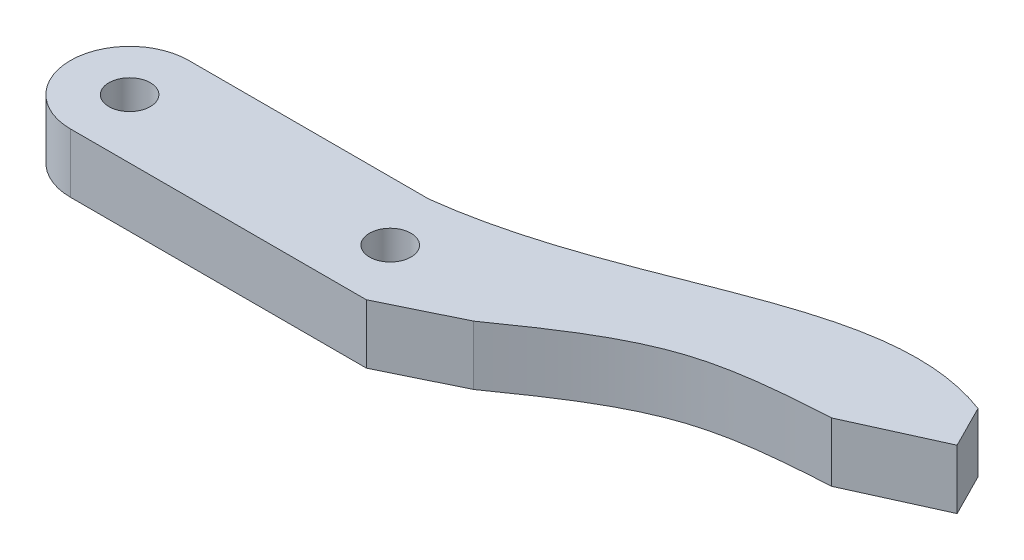
from build123d import *

# Parameters (mm, degrees)
SKETCH1_R           = 5
SKETCH1_R_2         = 1.75
BOSS_EXTRUDE1_DEPTH = 5
BOSS_EXTRUDE2_START = -5
BOSS_EXTRUDE2_DEPTH = 5


with BuildPart() as part:
    # Sketch1 → Boss-Extrude1 (new body)
    # profile 1 of 3: a face of its own
    with BuildSketch(Plane(origin=(0, 0, 0), x_dir=(1, 0, 0), z_dir=(0, 1, 0))):
        Circle(SKETCH1_R)
        with Locations(Location((0, 0, 0), (0, 0, 270))):
            Circle(SKETCH1_R_2, mode=Mode.SUBTRACT)
    # profile 2 of 3: a face of its own
    with BuildSketch(Plane(origin=(0, 0, 0), x_dir=(1, 0, 0), z_dir=(0, 1, 0))):
        with BuildLine():
            Line((22, 5), (7e-09, 5))
            ThreePointArc((7e-09, 5), (3.535533908, 3.535533903), (5, 0))
            ThreePointArc((5, 0), (3.535533907, -3.535533905), (3e-09, -5))
            Line((3e-09, -5), (22, -5))
            ThreePointArc((22, -5), (17, 0), (22, 5))
        make_face()
    # profile 3 of 3: a face of its own
    with BuildSketch(Plane(origin=(0, 0, 0), x_dir=(1, 0, 0), z_dir=(0, 1, 0))):
        with Locations((22, 0)):
            Circle(SKETCH1_R)
        with Locations(Location((22, 0, 0), (0, 0, 270))):
            Circle(SKETCH1_R_2, mode=Mode.SUBTRACT)
    extrude(amount=BOSS_EXTRUDE1_DEPTH)

    # Sketch2 → Boss-Extrude2 (add)
    with BuildSketch(Plane(origin=(0, 5, 0), x_dir=(1, 0, 0), z_dir=(0, 1, 0)).offset(BOSS_EXTRUDE2_START)):
        with BuildLine():
            ThreePointArc((22, 5), (27, 0), (22, -5))
            Line((22, -5), (24.99, -5))
            Line((24.99, -5), (31.08, -2.029708536))
            add(Edge.make_bspline(
                [(31.08, -2.029708536), (34.749760943, 0.550345092), (41.451086478, 5.261763501), (49.588688562, 5.770056828), (53.27, 6)],
                knots=[0, 0, 0, 0, 0.547617173, 1, 1, 1, 1], degree=3))
            Line((53.27, 6), (60.557013712, 9.301428655))
            Line((60.557013712, 9.301428655), (58.75, 12.87))
            add(Edge.make_bspline(
                [(20.251877892, 5), (35.741313443, 6.892403077), (46.679161054, 17.378023899), (58.75, 12.87)],
                knots=[0.158187399, 0.158187399, 0.158187399, 0.158187399, 1, 1, 1, 1], degree=3))
            Line((20.251877892, 5), (22, 5))
        make_face()
    extrude(amount=BOSS_EXTRUDE2_DEPTH)


solid = part.part
